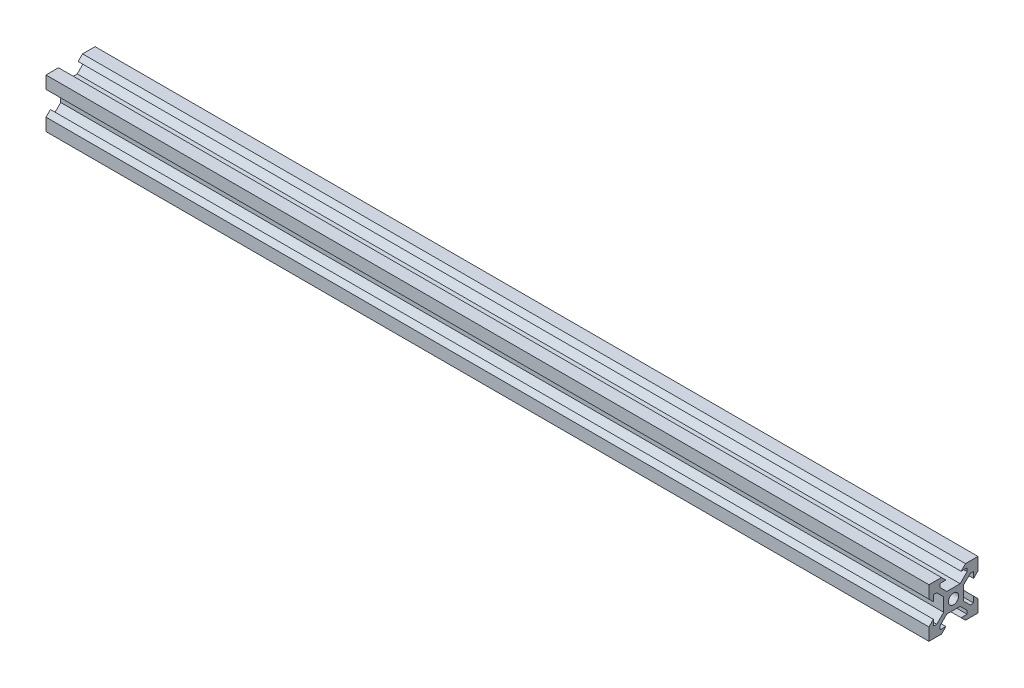
from build123d import *

# Parameters (mm, degrees)
SKETCH1_R           = 2.1
BOSS_EXTRUDE1_DEPTH = 360


with BuildPart() as part:
    # Sketch1 → Boss-Extrude1 (new body)
    with BuildSketch(Plane(origin=(0, 0, 0), x_dir=(0, 0, -1), z_dir=(1, 0, 0))):
        Polygon((6, 12.727207794), (6, 7.272792206), (3.171572875, 4.444365081), (1.8, 4.444365081), (1.8, 6.9), (0, 5.1), (0, 0), (5.1, 0), (6.9, 1.8), (4.444365081, 1.8), (4.444365081, 3.171572875), (7.272792206, 6), (12.727207794, 6), (15.555634919, 3.171572875), (15.555634919, 1.8), (13.1, 1.8), (14.9, 0), (20, 0), (20, 5.1), (18.2, 6.9), (18.2, 4.444365081), (16.828427125, 4.444365081), (14, 7.272792206), (14, 12.727207794), (16.828427125, 15.555634919), (18.2, 15.555634919), (18.2, 13.1), (20, 14.9), (20, 20), (14.9, 20), (13.1, 18.2), (15.555634919, 18.2), (15.555634919, 16.828427125), (12.727207794, 14), (7.272792206, 14), (4.444365081, 16.828427125), (4.444365081, 18.2), (6.9, 18.2), (5.1, 20), (0, 20), (0, 14.9), (1.8, 13.1), (1.8, 15.555634919), (3.171572875, 15.555634919), align=None)
        with Locations(Location((10, 10, 0), (0, 0, 180))):
            Circle(SKETCH1_R, mode=Mode.SUBTRACT)
    extrude(amount=BOSS_EXTRUDE1_DEPTH)


solid = part.part
